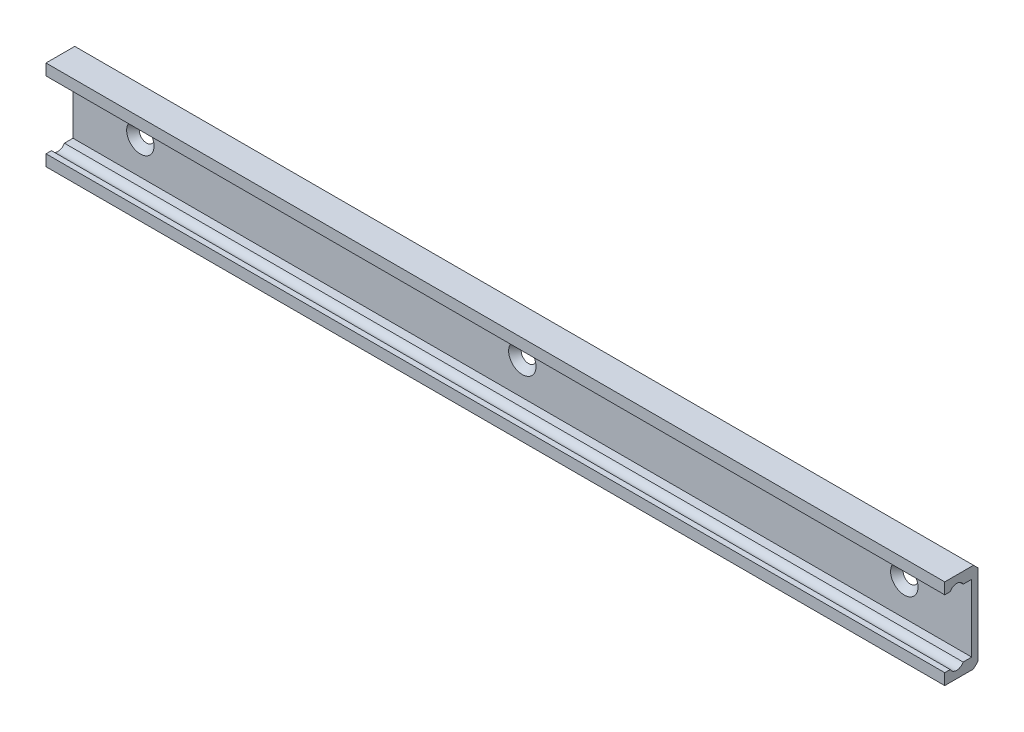
from build123d import *

# Parameters (mm, degrees)
BOSS_EXTRUDE1_DEPTH = 200
CHAMFER1_SIZE       = 1
LPATTERN1_COUNT     = 2
LPATTERN1_PITCH     = 85
LPATTERN2_COUNT     = 2
LPATTERN2_PITCH     = 170


with BuildPart() as part:
    # Sketch1 → Boss-Extrude1 (new body)
    with BuildSketch(Plane(origin=(-15, 0, 0), x_dir=(0, 0, -1), z_dir=(1, 0, 0))):
        with BuildLine():
            Line((-7.4, -7.5), (-7.4, -10))
            Line((-7.4, -10), (0, -10))
            Line((0, -10), (0, 10))
            Line((0, 10), (-7.4, 10))
            Line((-7.4, 10), (-7.4, 7.5))
            Line((-7.4, 7.5), (-6.191570324, 7.5))
            ThreePointArc((-6.191570324, 7.5), (-4.75, 8.375), (-3.308429676, 7.5))
            Line((-3.308429676, 7.5), (-1.4, 7.5))
            Line((-1.4, 7.5), (-1.4, -7.5))
            Line((-1.4, -7.5), (-3.308429676, -7.5))
            ThreePointArc((-3.308429676, -7.5), (-4.75, -8.375), (-6.191570324, -7.5))
            Line((-6.191570324, -7.5), (-7.4, -7.5))
        make_face()
    extrude(amount=BOSS_EXTRUDE1_DEPTH)

    # Chamfer1
    chamfer1_edges = [part.edges().sort_by_distance(p)[0] for p in [
        (85, 10, 0),
        (85, -10, 0),
    ]]
    chamfer(chamfer1_edges, length=CHAMFER1_SIZE)

    # Sketch2 → Cut-Revolve1 (revolve, cut)
    with BuildSketch(Plane(origin=(0, 0, 0), x_dir=(0, 0, -1), z_dir=(1, 0, 0))):
        Polygon((-1.4, 3.05), (0, 1.65), (0, 0), (-1.4, 0), align=None)
    cut_revolve1 = revolve(axis=Axis((0, 0, 0), (0, 0, 1)), mode=Mode.SUBTRACT)

    # LPattern1: Cut-Revolve1 ×2
    with Locations(*[(i * LPATTERN1_PITCH, 0, 0) for i in range(1, LPATTERN1_COUNT)]):
        add(cut_revolve1, mode=Mode.SUBTRACT)

    # LPattern2: Cut-Revolve1 ×2
    with Locations(*[(i * LPATTERN2_PITCH, 0, 0) for i in range(1, LPATTERN2_COUNT)]):
        add(cut_revolve1, mode=Mode.SUBTRACT)


solid = part.part
